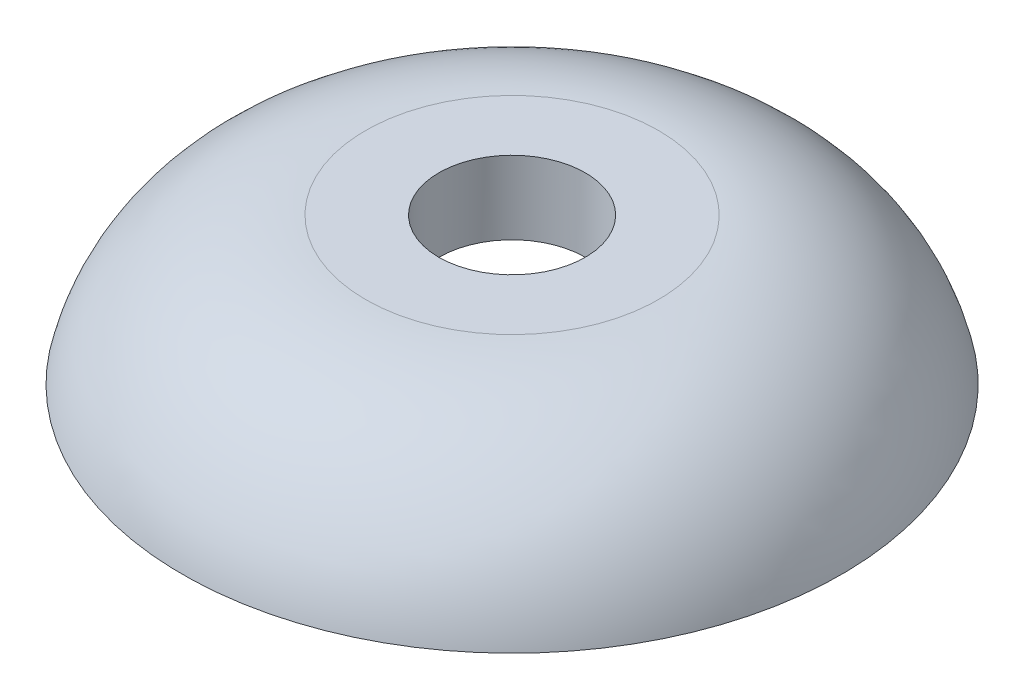
from build123d import *

# Parameters (mm, degrees)
ESBO_O2_R             = 2
CORTE_EXTRUS_O1_DEPTH = 10
ESBO_O3_R             = 5.25
CORTE_EXTRUS_O2_DEPTH = 2
FILETE1_R             = 1.5


with BuildPart() as part:
    # Esboço1 → Revolução1 (revolve)
    with BuildSketch(Plane.XY, mode=Mode.PRIVATE) as revolu_o1_sk:
        with BuildLine():
            Line((0, 0), (0, 4))
            Line((0, 4), (4, 4))
            ThreePointArc((4, 4), (7.201562119, 2.876952648), (9, 0))
            Line((9, 0), (0, 0))
        make_face()
    revolve(revolu_o1_sk.sketch.rotate(Axis((0, 0, 0), (0, 1, 0)), 90), axis=Axis((0, 0, 0), (0, 1, 0)))

    # Esboço2 → Corte-extrusão1 (cut)
    with BuildSketch(Plane(origin=(0, 4, 0), x_dir=(1, 0, 0), z_dir=(0, 1, 0))):
        with Locations(Location((0, 0, 0), (0, 0, 270))):
            Circle(ESBO_O2_R)
    extrude(amount=-CORTE_EXTRUS_O1_DEPTH, mode=Mode.SUBTRACT)

    # Esboço3 → Corte-extrusão2 (cut)
    with BuildSketch(Plane.XZ):
        with Locations(Location((0, 0, 0), (0, 0, 270))):
            Circle(ESBO_O3_R)
    extrude(amount=-CORTE_EXTRUS_O2_DEPTH, mode=Mode.SUBTRACT)

    # Filete1
    filete1_edges = [part.edges().sort_by_distance(p)[0] for p in [
        (0, 2, 5.25),
    ]]
    fillet(filete1_edges, radius=FILETE1_R)


solid = part.part
